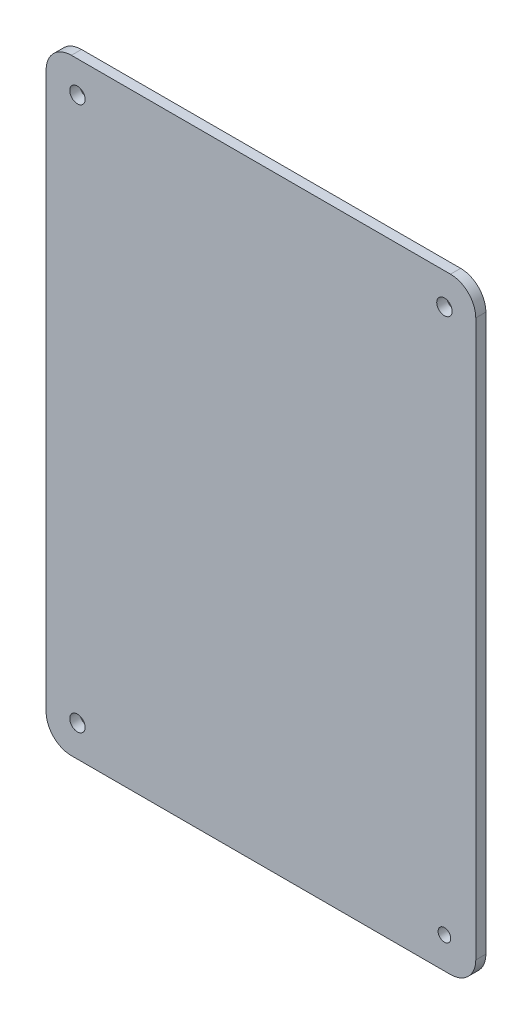
from build123d import *

# Parameters (mm, degrees)
SKETCH1_R                   = 1.25
SKETCH1_R_2                 = 1.525
BOSS_EXTRUDE1_DEPTH         = 2
SKETCH3_R                   = 2
BOSS_EXTRUDE2_DEPTH         = 8
M3_TAPPED_HOLE1_D           = 2.5
M3_TAPPED_HOLE1_DEPTH       = 6
M3_TAPPED_HOLE1_CSINK_D     = 3.05
M3_TAPPED_HOLE1_CSINK_ANGLE = 90
M3_TAPPED_HOLE1_TIP         = 0.751075774
FILLET1_R                   = 2


with BuildPart() as part:
    # Sketch1 → Boss-Extrude1 (new body)
    with BuildSketch(Plane.XY):
        with BuildLine():
            Line((-37.5, 57.260829493), (37.5, 57.260829493))
            ThreePointArc((37.5, 57.260829493), (41.035533906, 55.796363399), (42.5, 52.260829493))
            Line((42.5, 52.260829493), (42.5, -57.739170507))
            ThreePointArc((42.5, -57.739170507), (41.035533906, -61.274704413), (37.5, -62.739170507))
            Line((37.5, -62.739170507), (-37.5, -62.739170507))
            ThreePointArc((-37.5, -62.739170507), (-41.035533906, -61.274704413), (-42.5, -57.739170507))
            Line((-42.5, -57.739170507), (-42.5, 52.260829493))
            ThreePointArc((-42.5, 52.260829493), (-41.035533906, 55.796363399), (-37.5, 57.260829493))
        make_face()
        with Locations((36.3, -56.539170507)):
            Circle(SKETCH1_R, mode=Mode.SUBTRACT)
        with Locations((36.3, 51.060829493)):
            Circle(SKETCH1_R_2, mode=Mode.SUBTRACT)
        with Locations((-36.3, 51.060829493)):
            Circle(SKETCH1_R_2, mode=Mode.SUBTRACT)
        with Locations((-36.3, -56.539170507)):
            Circle(SKETCH1_R_2, mode=Mode.SUBTRACT)
    extrude(amount=BOSS_EXTRUDE1_DEPTH)

    # Sketch3 → Boss-Extrude2 (add)
    with BuildSketch(Plane(origin=(0, 0, 0), x_dir=(-1, 0, 0), z_dir=(0, 0, -1))):
        with Locations((-19.5, 36.260829493)):
            Circle(SKETCH3_R)
        with Locations((19.5, 36.260829493)):
            Circle(SKETCH3_R)
        with Locations((19.5, -2.739170507)):
            Circle(SKETCH3_R)
        with Locations((-19.5, -2.739170507)):
            Circle(SKETCH3_R)
    extrude(amount=BOSS_EXTRUDE2_DEPTH)

    # M3 Tapped Hole1
    with Locations(Plane(origin=(0, 0, -8), x_dir=(-1, 0, 0), z_dir=(0, 0, -1))):
        with Locations((-19.5, -2.739170507), (-19.5, 36.260829493), (19.5, 36.260829493), (19.5, -2.739170507)):
            CounterSinkHole(M3_TAPPED_HOLE1_D / 2, M3_TAPPED_HOLE1_CSINK_D / 2, depth=M3_TAPPED_HOLE1_DEPTH, counter_sink_angle=M3_TAPPED_HOLE1_CSINK_ANGLE)
            with Locations((0, 0, -(M3_TAPPED_HOLE1_DEPTH + M3_TAPPED_HOLE1_TIP / 2))):  # 118° drill point
                Cone(0, M3_TAPPED_HOLE1_D / 2, M3_TAPPED_HOLE1_TIP, mode=Mode.SUBTRACT)

    # Fillet1
    fillet1_edges = [part.edges().sort_by_distance(p)[0] for p in [
        (21.5, 36.260829493, 0),
        (-17.5, 36.260829493, 0),
        (-17.5, -2.739170507, 0),
        (21.5, -2.739170507, 0),
    ]]
    fillet(fillet1_edges, radius=FILLET1_R)


solid = part.part
